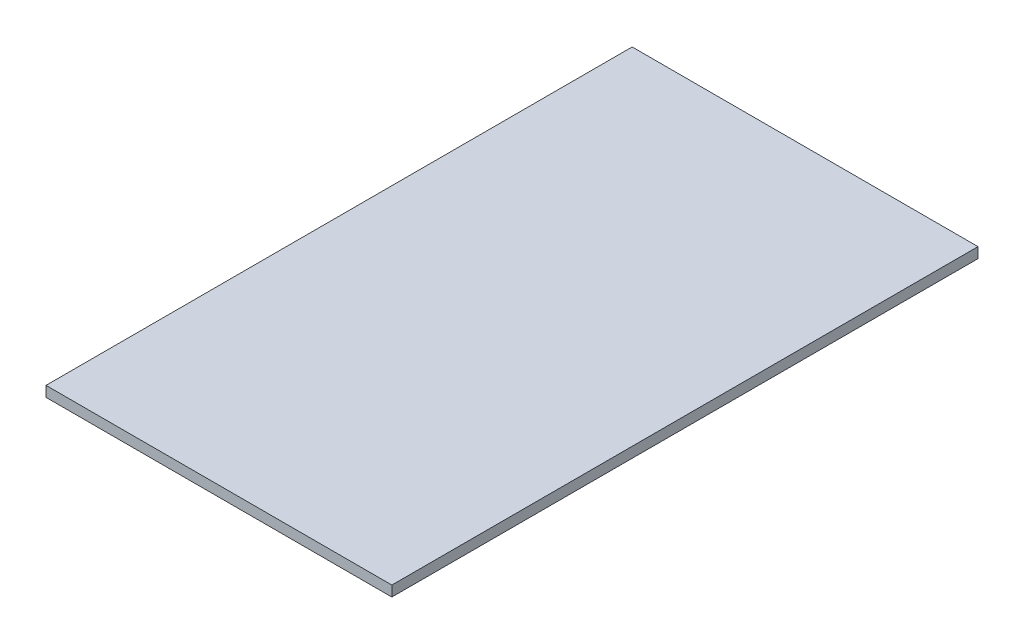
from build123d import *

# Parameters (mm, degrees)
CROQUIS1_W              = 265.505
CROQUIS1_H              = 450
SALIENTE_EXTRUIR1_DEPTH = 4


with BuildPart() as part:
    # Croquis1 → Saliente-Extruir1 (new, symmetric)
    with BuildSketch(Plane(origin=(0, 254.707138557, 0), x_dir=(1, 0, 0), z_dir=(0, 1, 0))):
        with Locations((-52.099536721, -265)):
            Rectangle(CROQUIS1_W, CROQUIS1_H)
    extrude(amount=SALIENTE_EXTRUIR1_DEPTH, both=True)


solid = part.part
